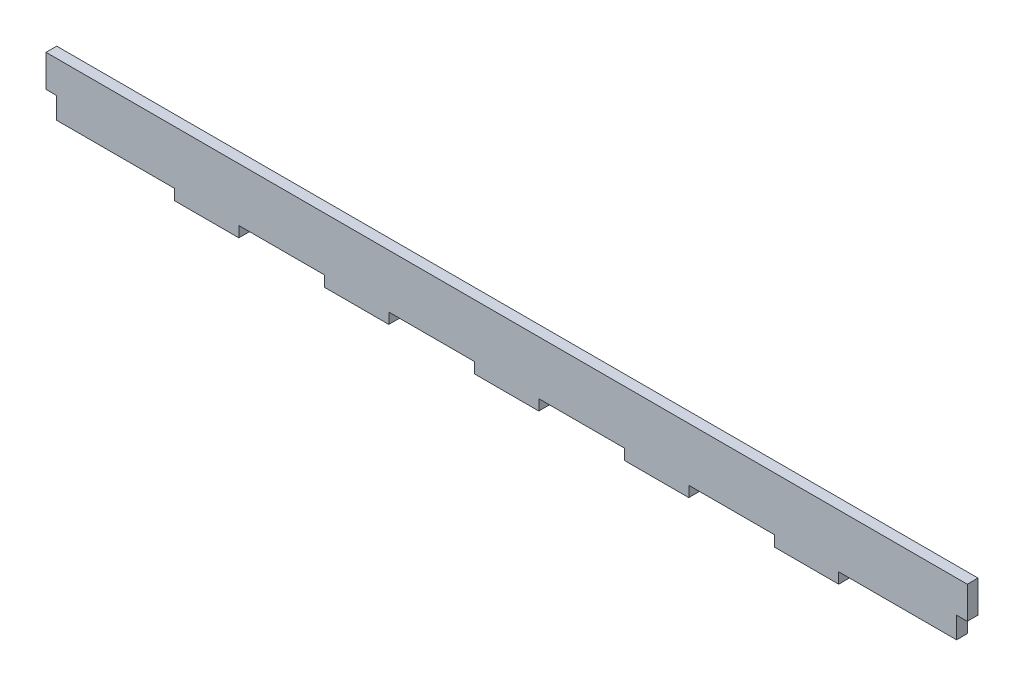
from build123d import *

# Parameters (mm, degrees)
BOSS_EXTRUDE1_DEPTH = 5


with BuildPart() as part:
    # Sketch1 → Boss-Extrude1 (new body)
    with BuildSketch(Plane.XY):
        Polygon((-435, -420), (-435, -430), (-380, -430), (-380, -435), (-350, -435), (-350, -430), (-310, -430), (-310, -435), (-280, -435), (-280, -430), (-240, -430), (-240, -435), (-210, -435), (-210, -430), (-170, -430), (-170, -435), (-140, -435), (-140, -430), (-100, -430), (-100, -435), (-70, -435), (-70, -430), (-15, -430), (-15, -420), (-10, -420), (-10, -405), (-440, -405), (-440, -420), align=None)
    extrude(amount=BOSS_EXTRUDE1_DEPTH)


solid = part.part
